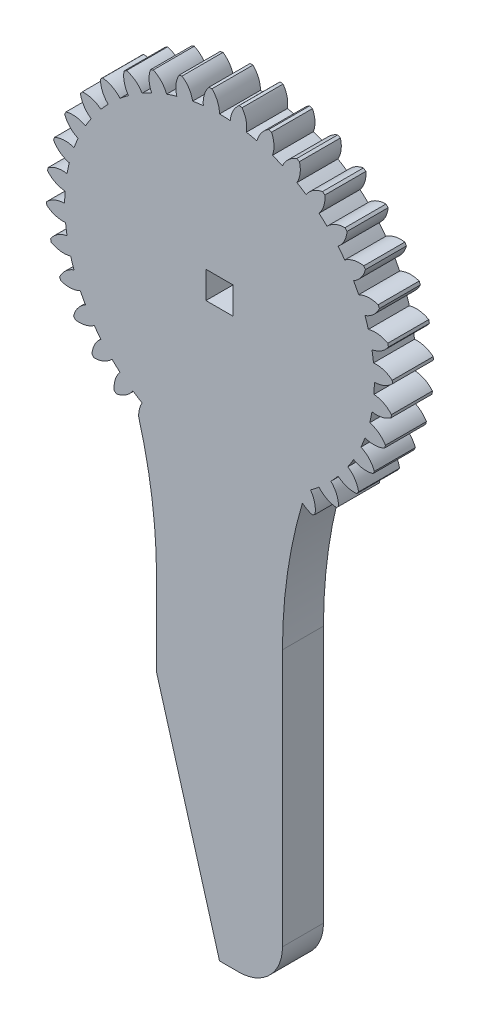
from build123d import *

# Parameters (mm, degrees)
SKETCH3_W           = 3.1496
SKETCH3_H           = 3.1496
BOSS_EXTRUDE2_DEPTH = 4.7625


with BuildPart() as part:
    # Sketch3 → Boss-Extrude2 (new body)
    with BuildSketch(Plane.XY):
        with BuildLine():
            Line((-7.315565262, -32.266141183), (-7.315565262, -41.831028601))
            Line((-7.315565262, -41.831028601), (0, -67.231028601))
            Line((0, -67.231028601), (2.235565262, -67.231028601))
            ThreePointArc((2.235565262, -67.231028601), (5.827667711, -65.74313105), (7.315565262, -62.151028601))
            Line((7.315565262, -62.151028601), (7.315565262, -32.266141183))
            ThreePointArc((7.315565262, -32.266141183), (7.897659416, -24.22151509), (9.631814689, -16.344488489))
            ThreePointArc((9.631814689, -16.344488489), (10.18225165, -16.71633878), (10.801925056, -16.955625965))
            ThreePointArc((10.801925056, -16.955625965), (10.949477624, -16.860716964), (11.096196346, -16.764523955))
            ThreePointArc((11.096196346, -16.764523955), (11.055956494, -15.605192192), (10.571905548, -14.55097966))
            ThreePointArc((10.571905548, -14.55097966), (11.073287295, -14.173161414), (11.561177947, -13.778075354))
            ThreePointArc((11.561177947, -13.778075354), (12.46697334, -14.502785012), (13.582133093, -14.822297307))
            ThreePointArc((13.582133093, -14.822297307), (13.710963231, -14.703207953), (13.838749226, -14.582998892))
            ThreePointArc((13.838749226, -14.582998892), (13.597804859, -13.448267561), (12.938045649, -12.49412545))
            ThreePointArc((12.938045649, -12.49412545), (13.366202831, -12.034983086), (13.778075353, -11.561177948))
            ThreePointArc((13.778075353, -11.561177948), (14.79595419, -12.117587919), (15.949654889, -12.238600645))
            ThreePointArc((15.949654889, -12.238600645), (16.055848158, -12.098949408), (16.160818711, -11.958376788))
            ThreePointArc((16.160818711, -11.958376788), (15.726490803, -10.882724126), (14.911069779, -10.057643562))
            ThreePointArc((14.911069779, -10.057643562), (15.252993057, -9.531127887), (15.576332912, -8.993))
            ThreePointArc((15.576332912, -8.993), (16.675367459, -9.364204049), (17.832554491, -9.283040296))
            ThreePointArc((17.832554491, -9.283040296), (17.912884263, -9.127070406), (17.991849899, -8.970405455))
            ThreePointArc((17.991849899, -8.970405455), (17.377335283, -7.986514623), (16.431028601, -7.315565262))
            ThreePointArc((16.431028601, -7.315565262), (16.676328808, -6.737674189), (16.901311478, -6.151574298))
            ThreePointArc((16.901311478, -6.151574298), (18.048108127, -6.326293576), (19.173620949, -6.045419464))
            ThreePointArc((19.173620949, -6.045419464), (19.225646444, -5.877869989), (19.276207831, -5.709872891))
            ThreePointArc((19.276207831, -5.709872891), (18.500178224, -4.847638915), (17.451738932, -4.351207214))
            ThreePointArc((17.451738932, -4.351207214), (17.592962746, -3.739499671), (17.712752245, -3.123236125))
            ThreePointArc((17.712752245, -3.123236125), (18.872466161, -3.096161876), (19.932106638, -2.624111621))
            ThreePointArc((19.932106638, -2.624111621), (19.954247087, -2.450073467), (19.974867944, -2.27584873))
            ThreePointArc((19.974867944, -2.27584873), (19.060902611, -1.561470153), (17.942187008, -1.254639936))
            ThreePointArc((17.942187008, -1.254639936), (17.975043415, -0.627702348), (17.986, 0))
            ThreePointArc((17.986, 0), (19.123393861, 0.228045138), (20.084965351, 0.876928525))
            ThreePointArc((20.084965351, 0.876928525), (20.076548029, 1.052167297), (20.066601801, 1.227325943))
            ThreePointArc((20.066601801, 1.227325943), (19.042471117, 1.772143089), (17.887470811, 1.88004894))
            ThreePointArc((17.887470811, 1.88004894), (17.810961485, 2.503167394), (17.712752246, 3.123236124))
            ThreePointArc((17.712752246, 3.123236124), (18.793266916, 3.545323115), (19.627552557, 4.351323642))
            ThreePointArc((19.627552557, 4.351323642), (19.588833219, 4.522438491), (19.548622116, 4.693208939))
            ThreePointArc((19.548622116, 4.693208939), (18.445443774, 5.051910662), (17.289252863, 4.957613482))
            ThreePointArc((17.289252863, 4.957613482), (17.105702502, 5.557979661), (16.901311478, 6.151574297))
            ThreePointArc((16.901311478, 6.151574297), (17.892116065, 6.754878242), (18.573766509, 7.693505992))
            ThreePointArc((18.573766509, 7.693505992), (18.505921624, 7.85529768), (18.436667441, 8.016491156))
            ThreePointArc((18.436667441, 8.016491156), (17.287960956, 8.178178485), (16.165709716, 7.884543445))
            ThreePointArc((16.165709716, 7.884543445), (15.880695405, 8.443915527), (15.576332913, 8.992999999))
            ThreePointArc((15.576332913, 8.992999999), (16.447322322, 9.759189812), (16.955625965, 10.801925056))
            ThreePointArc((16.955625965, 10.801925056), (16.860716964, 10.949477624), (16.764523955, 11.096196346))
            ThreePointArc((16.764523955, 11.096196346), (15.605192192, 11.055956494), (14.55097966, 10.571905548))
            ThreePointArc((14.55097966, 10.571905548), (14.173161414, 11.073287295), (13.778075354, 11.561177947))
            ThreePointArc((13.778075354, 11.561177947), (14.502785012, 12.46697334), (14.822297307, 13.582133093))
            ThreePointArc((14.822297307, 13.582133093), (14.703207953, 13.710963231), (14.582998892, 13.838749226))
            ThreePointArc((14.582998892, 13.838749226), (13.448267561, 13.597804859), (12.49412545, 12.938045649))
            ThreePointArc((12.49412545, 12.938045649), (12.034983086, 13.366202831), (11.561177948, 13.778075353))
            ThreePointArc((11.561177948, 13.778075353), (12.117587919, 14.79595419), (12.238600645, 15.949654889))
            ThreePointArc((12.238600645, 15.949654889), (12.098949408, 16.055848158), (11.958376788, 16.160818711))
            ThreePointArc((11.958376788, 16.160818711), (10.882724126, 15.726490803), (10.057643562, 14.911069779))
            ThreePointArc((10.057643562, 14.911069779), (9.531127887, 15.252993057), (8.993, 15.576332912))
            ThreePointArc((8.993, 15.576332912), (9.364204049, 16.675367459), (9.283040296, 17.832554491))
            ThreePointArc((9.283040296, 17.832554491), (9.127070406, 17.912884263), (8.970405455, 17.991849899))
            ThreePointArc((8.970405455, 17.991849899), (7.986514623, 17.377335283), (7.315565262, 16.431028601))
            ThreePointArc((7.315565262, 16.431028601), (6.737674189, 16.676328808), (6.151574298, 16.901311478))
            ThreePointArc((6.151574298, 16.901311478), (6.326293576, 18.048108127), (6.045419464, 19.173620949))
            ThreePointArc((6.045419464, 19.173620949), (5.877869989, 19.225646444), (5.709872891, 19.276207831))
            ThreePointArc((5.709872891, 19.276207831), (4.847638915, 18.500178224), (4.351207214, 17.451738932))
            ThreePointArc((4.351207214, 17.451738932), (3.739499671, 17.592962746), (3.123236125, 17.712752245))
            ThreePointArc((3.123236125, 17.712752245), (3.096161876, 18.872466161), (2.624111621, 19.932106638))
            ThreePointArc((2.624111621, 19.932106638), (2.450073467, 19.954247087), (2.27584873, 19.974867944))
            ThreePointArc((2.27584873, 19.974867944), (1.561470153, 19.060902611), (1.254639936, 17.942187008))
            ThreePointArc((1.254639936, 17.942187008), (0.627702348, 17.975043415), (0, 17.986))
            ThreePointArc((0, 17.986), (-0.228045138, 19.123393861), (-0.876928525, 20.084965351))
            ThreePointArc((-0.876928525, 20.084965351), (-1.052167297, 20.076548029), (-1.227325943, 20.066601801))
            ThreePointArc((-1.227325943, 20.066601801), (-1.772143089, 19.042471117), (-1.88004894, 17.887470811))
            ThreePointArc((-1.88004894, 17.887470811), (-2.503167394, 17.810961485), (-3.123236124, 17.712752246))
            ThreePointArc((-3.123236124, 17.712752246), (-3.545323115, 18.793266916), (-4.351323642, 19.627552557))
            ThreePointArc((-4.351323642, 19.627552557), (-4.522438491, 19.588833219), (-4.693208939, 19.548622116))
            ThreePointArc((-4.693208939, 19.548622116), (-5.051910662, 18.445443774), (-4.957613482, 17.289252863))
            ThreePointArc((-4.957613482, 17.289252863), (-5.557979661, 17.105702502), (-6.151574297, 16.901311478))
            ThreePointArc((-6.151574297, 16.901311478), (-6.754878242, 17.892116065), (-7.693505992, 18.573766509))
            ThreePointArc((-7.693505992, 18.573766509), (-7.85529768, 18.505921624), (-8.016491156, 18.436667441))
            ThreePointArc((-8.016491156, 18.436667441), (-8.178178485, 17.287960956), (-7.884543445, 16.165709716))
            ThreePointArc((-7.884543445, 16.165709716), (-8.443915527, 15.880695405), (-8.992999999, 15.576332913))
            ThreePointArc((-8.992999999, 15.576332913), (-9.759189812, 16.447322322), (-10.801925056, 16.955625965))
            ThreePointArc((-10.801925056, 16.955625965), (-10.949477624, 16.860716964), (-11.096196346, 16.764523955))
            ThreePointArc((-11.096196346, 16.764523955), (-11.055956494, 15.605192192), (-10.571905548, 14.55097966))
            ThreePointArc((-10.571905548, 14.55097966), (-11.073287295, 14.173161414), (-11.561177947, 13.778075354))
            ThreePointArc((-11.561177947, 13.778075354), (-12.46697334, 14.502785012), (-13.582133093, 14.822297307))
            ThreePointArc((-13.582133093, 14.822297307), (-13.710963231, 14.703207953), (-13.838749226, 14.582998892))
            ThreePointArc((-13.838749226, 14.582998892), (-13.597804859, 13.448267561), (-12.938045649, 12.49412545))
            ThreePointArc((-12.938045649, 12.49412545), (-13.366202831, 12.034983086), (-13.778075353, 11.561177948))
            ThreePointArc((-13.778075353, 11.561177948), (-14.79595419, 12.117587919), (-15.949654889, 12.238600645))
            ThreePointArc((-15.949654889, 12.238600645), (-16.055848158, 12.098949408), (-16.160818711, 11.958376788))
            ThreePointArc((-16.160818711, 11.958376788), (-15.726490803, 10.882724126), (-14.911069779, 10.057643563))
            ThreePointArc((-14.911069779, 10.057643563), (-15.252993057, 9.531127887), (-15.576332912, 8.993000001))
            ThreePointArc((-15.576332912, 8.993000001), (-16.67536746, 9.364204049), (-17.832554491, 9.283040296))
            ThreePointArc((-17.832554491, 9.283040296), (-17.912884263, 9.127070406), (-17.991849899, 8.970405455))
            ThreePointArc((-17.991849899, 8.970405455), (-17.377335283, 7.986514623), (-16.431028601, 7.315565262))
            ThreePointArc((-16.431028601, 7.315565262), (-16.676328808, 6.737674189), (-16.901311478, 6.151574298))
            ThreePointArc((-16.901311478, 6.151574298), (-18.048108127, 6.326293576), (-19.173620949, 6.045419464))
            ThreePointArc((-19.173620949, 6.045419464), (-19.225646444, 5.877869989), (-19.276207831, 5.709872891))
            ThreePointArc((-19.276207831, 5.709872891), (-18.500178224, 4.847638915), (-17.451738932, 4.351207214))
            ThreePointArc((-17.451738932, 4.351207214), (-17.592962746, 3.739499671), (-17.712752245, 3.123236125))
            ThreePointArc((-17.712752245, 3.123236125), (-18.872466161, 3.096161876), (-19.932106638, 2.624111621))
            ThreePointArc((-19.932106638, 2.624111621), (-19.954247087, 2.450073467), (-19.974867944, 2.27584873))
            ThreePointArc((-19.974867944, 2.27584873), (-19.060902611, 1.561470153), (-17.942187008, 1.254639936))
            ThreePointArc((-17.942187008, 1.254639936), (-17.975043415, 0.627702348), (-17.986, 0))
            ThreePointArc((-17.986, 0), (-19.123393861, -0.228045138), (-20.084965351, -0.876928525))
            ThreePointArc((-20.084965351, -0.876928525), (-20.076548029, -1.052167297), (-20.066601801, -1.227325943))
            ThreePointArc((-20.066601801, -1.227325943), (-19.042471117, -1.772143089), (-17.887470811, -1.88004894))
            ThreePointArc((-17.887470811, -1.88004894), (-17.810961485, -2.503167394), (-17.712752246, -3.123236124))
            ThreePointArc((-17.712752246, -3.123236124), (-18.793266916, -3.545323115), (-19.627552557, -4.351323642))
            ThreePointArc((-19.627552557, -4.351323642), (-19.588833219, -4.522438491), (-19.548622116, -4.693208939))
            ThreePointArc((-19.548622116, -4.693208939), (-18.445443774, -5.051910662), (-17.289252863, -4.957613482))
            ThreePointArc((-17.289252863, -4.957613482), (-17.105702502, -5.557979661), (-16.901311478, -6.151574297))
            ThreePointArc((-16.901311478, -6.151574297), (-17.892116065, -6.754878242), (-18.573766509, -7.693505992))
            ThreePointArc((-18.573766509, -7.693505992), (-18.505921624, -7.85529768), (-18.436667441, -8.016491156))
            ThreePointArc((-18.436667441, -8.016491156), (-17.287960956, -8.178178485), (-16.165709716, -7.884543445))
            ThreePointArc((-16.165709716, -7.884543445), (-15.880695405, -8.443915527), (-15.576332913, -8.992999999))
            ThreePointArc((-15.576332913, -8.992999999), (-16.447322322, -9.759189812), (-16.955625965, -10.801925056))
            ThreePointArc((-16.955625965, -10.801925056), (-16.860716964, -10.949477624), (-16.764523955, -11.096196346))
            ThreePointArc((-16.764523955, -11.096196346), (-15.605192192, -11.055956494), (-14.55097966, -10.571905548))
            ThreePointArc((-14.55097966, -10.571905548), (-14.173161414, -11.073287295), (-13.778075354, -11.561177947))
            ThreePointArc((-13.778075354, -11.561177947), (-14.502785012, -12.46697334), (-14.822297307, -13.582133093))
            ThreePointArc((-14.822297307, -13.582133093), (-14.703207953, -13.710963231), (-14.582998892, -13.838749226))
            ThreePointArc((-14.582998892, -13.838749226), (-13.448267561, -13.597804859), (-12.49412545, -12.938045649))
            ThreePointArc((-12.49412545, -12.938045649), (-12.034983086, -13.366202831), (-11.561177948, -13.778075353))
            ThreePointArc((-11.561177948, -13.778075353), (-12.117587919, -14.79595419), (-12.238600645, -15.949654889))
            ThreePointArc((-12.238600645, -15.949654889), (-12.098949408, -16.055848158), (-11.958376788, -16.160818711))
            ThreePointArc((-11.958376788, -16.160818711), (-10.882724126, -15.726490803), (-10.057643562, -14.911069779))
            ThreePointArc((-10.057643562, -14.911069779), (-9.531127887, -15.252993057), (-8.993, -15.576332912))
            ThreePointArc((-8.993, -15.576332912), (-9.306253553, -16.360666423), (-9.38446638, -17.201612081))
            ThreePointArc((-9.38446638, -17.201612081), (-7.835206676, -24.663174839), (-7.315565262, -32.266141183))
        make_face()
        Rectangle(SKETCH3_W, SKETCH3_H, mode=Mode.SUBTRACT)
    extrude(amount=BOSS_EXTRUDE2_DEPTH)


solid = part.part
